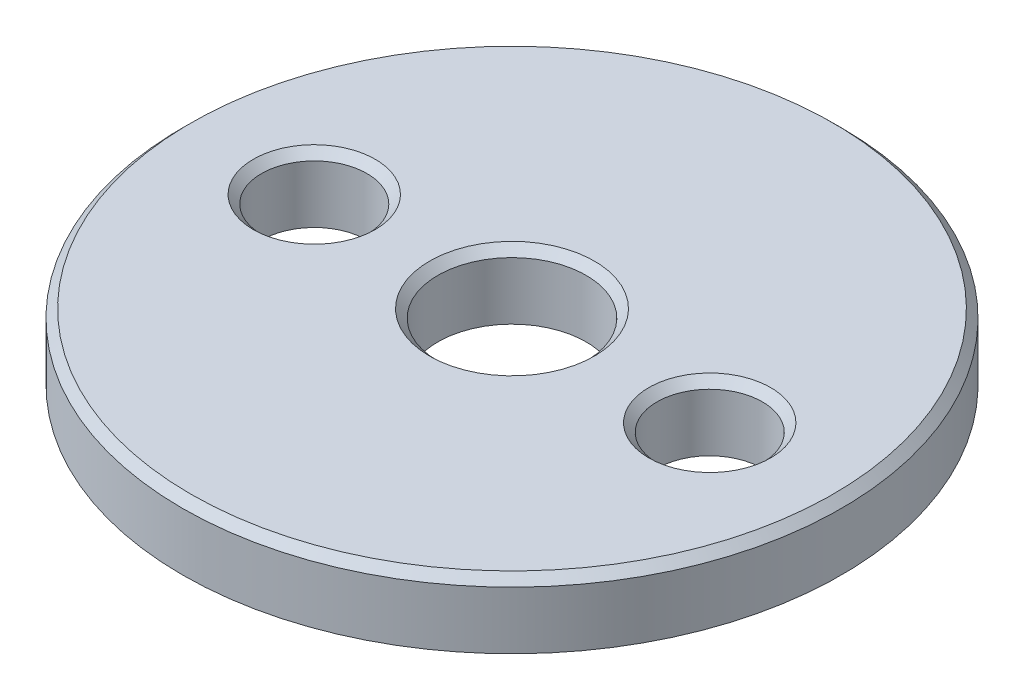
from build123d import *

# Parameters (mm, degrees)
SKETCH1_R           = 10
SKETCH1_R_2         = 1.6
SKETCH1_R_3         = 2.25
BOSS_EXTRUDE1_DEPTH = 2
CHAMFER1_SIZE       = 0.25


with BuildPart() as part:
    # Sketch1 → Boss-Extrude1 (new body)
    with BuildSketch(Plane(origin=(0, 0, 0), x_dir=(1, 0, 0), z_dir=(0, 1, 0))):
        with Locations(Location((0, 0, 0), (0, 0, 270))):
            Circle(SKETCH1_R)
        with Locations(Location((-6, 0, 0), (0, 0, 270))):
            Circle(SKETCH1_R_2, mode=Mode.SUBTRACT)
        with Locations(Location((6, 0, 0), (0, 0, 270))):
            Circle(SKETCH1_R_2, mode=Mode.SUBTRACT)
        with Locations(Location((0, 0, 0), (0, 0, 270))):
            Circle(SKETCH1_R_3, mode=Mode.SUBTRACT)
    extrude(amount=BOSS_EXTRUDE1_DEPTH)

    # Chamfer1
    chamfer1_edges = [part.edges().sort_by_distance(p)[0] for p in [
        (0, 2, -2.25),
        (0, 2, -10),
        (-6, 2, -1.6),
        (6, 2, -1.6),
    ]]
    chamfer(chamfer1_edges, length=CHAMFER1_SIZE)


solid = part.part
